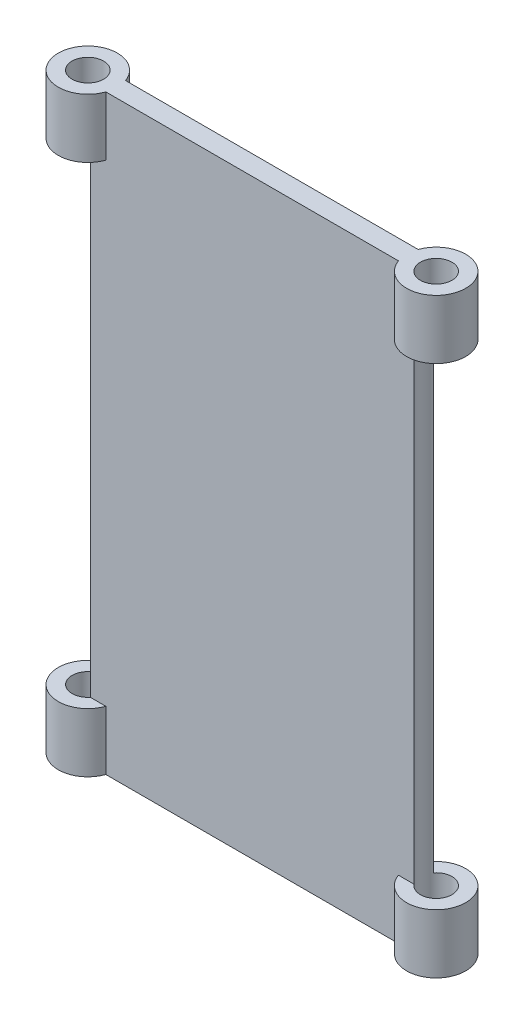
from build123d import *

# Parameters (mm, degrees)
SKETCH_1_W          = 88.39
SKETCH_1_H          = 150
EXTRUDE_1_DEPTH     = 5
SKETCH_2_R          = 7.5
EXTRUDE_2_DEPTH     = 15
HOLE_WIZARD_1_D     = 8
EXTRUDE_3_DEPTH     = 15
SKETCH_8_R          = 4
CUT_EXTRUDE_1_DEPTH = 166.891205614


with BuildPart() as part:
    # 스케치1 → 보스-돌출1 (new body)
    with BuildSketch(Plane.XY):
        with Locations((44.195, 75)):
            Rectangle(SKETCH_1_W, SKETCH_1_H)
    extrude(amount=EXTRUDE_1_DEPTH)

    # 스케치2 → 보스-돌출2 (add)
    with BuildSketch(Plane(origin=(0, 150, 0), x_dir=(1, 0, 0), z_dir=(0, 1, 0))):
        with Locations((88.39, -2.5)):
            Circle(SKETCH_2_R)
        with Locations((0, -2.5)):
            Circle(SKETCH_2_R)
    extrude(amount=-EXTRUDE_2_DEPTH)

    # 구멍1 (through all)
    with Locations(Plane(origin=(0, 150, 0), x_dir=(1, 0, 0), z_dir=(0, 1, 0))):
        with Locations((0, -2.5), (88.39, -2.5)):
            Hole(HOLE_WIZARD_1_D / 2)

    # 스케치7 → 보스-돌출3 (add)
    with BuildSketch(Plane.XZ):
        with BuildLine():
            Line((81.318932188, 0), (85.267501001, 0))
            ThreePointArc((85.267501001, 0), (84.39, 2.5), (85.267501001, 5))
            Line((85.267501001, 5), (81.318932188, 5))
            ThreePointArc((81.318932188, 5), (95.89, 2.5), (81.318932188, 0))
        make_face()
        with BuildLine():
            Line((3.122498999, 5), (7.071067812, 5))
            ThreePointArc((7.071067812, 5), (-7.5, 2.5), (7.071067812, 0))
            Line((7.071067812, 0), (3.122498999, 0))
            ThreePointArc((3.122498999, 0), (4, 2.5), (3.122498999, 5))
        make_face()
    extrude(amount=-EXTRUDE_3_DEPTH)

    # 스케치8 → 컷-돌출1 (cut, through all)
    with BuildSketch(Plane(origin=(0, 15, 0), x_dir=(1, 0, 0), z_dir=(0, 1, 0))):
        with Locations(Location((0, -2.5, 0), (0, 0, 270))):
            Circle(SKETCH_8_R)
        with Locations(Location((88.39, -2.5, 0), (0, 0, 270))):
            Circle(SKETCH_8_R)
    extrude(amount=-CUT_EXTRUDE_1_DEPTH, mode=Mode.SUBTRACT)


solid = part.part
